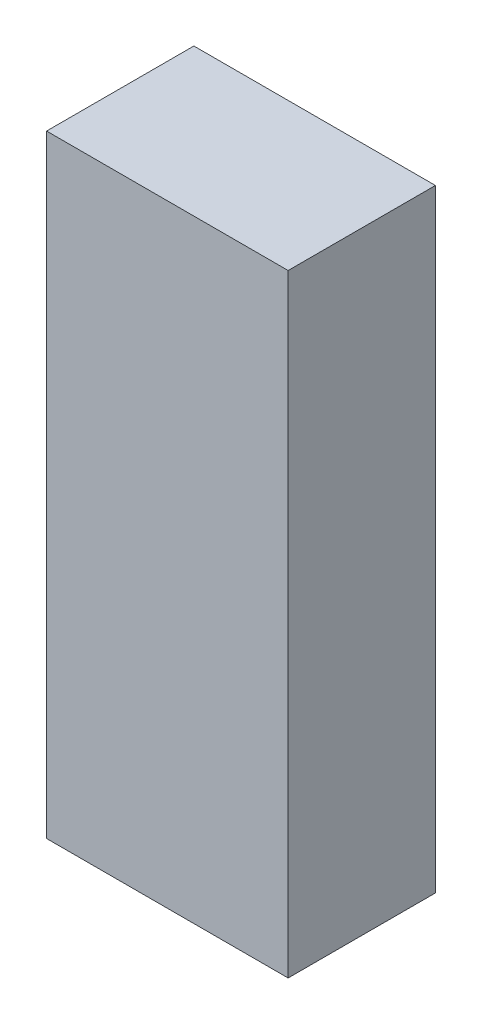
from build123d import *

# Parameters (mm, degrees)
SKETCH_1_W              = 2.05
SKETCH_1_H              = 5.2
COMPONENT_OUTLINE_DEPTH = 1.25


with BuildPart() as part:
    # 草图1 → Component_Outline (new body)
    with BuildSketch(Plane.XY):
        Rectangle(SKETCH_1_W, SKETCH_1_H)
    extrude(amount=COMPONENT_OUTLINE_DEPTH)


solid = part.part
